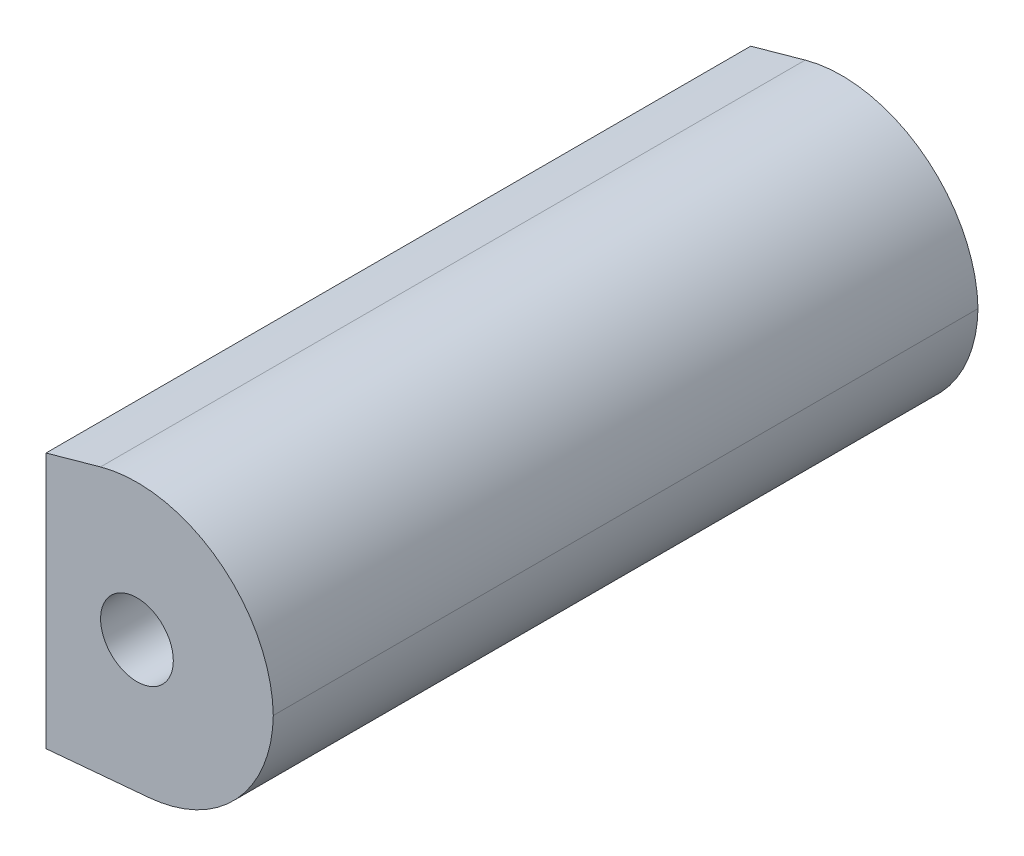
from build123d import *

# Parameters (mm, degrees)
SKETCH1_R               = 2.032
BOSS_EXTRUDE1_DEPTH     = 39.37
CUT_EXTRUDE2_DEPTH      = 62.664828162
CUT_EXTRUDE2_DEPTH_BACK = 62.664828162
SKETCH3_W               = 64.931431167
SKETCH3_H               = 41.251540677


with BuildPart() as part:
    # Sketch1 → Boss-Extrude1 (new body)
    with BuildSketch(Plane.XY):
        with BuildLine():
            ThreePointArc((20.568025107, -2.262743193), (25.492605461, 0.119444869), (27.551899423, 5.187543131))
            ThreePointArc((27.551899423, 5.187543131), (24.489282859, 11.152254923), (17.899072442, 12.38778462))
            add(Edge.make_bspline(
                [(17.899072442, 12.38778462), (11.779016726, 10.69250234), (-2.958574168, 6.431868525), (-24.080278159, -0.407648755), (-34.99363821, -4.735815006), (-48.537358713, -9.634849887), (-43.566754384, -9.118513058)],
                knots=[0, 0, 0, 0, 0.056261028, 0.133578719, 0.179880978, 0.203822749, 0.203822749, 0.203822749, 0.203822749], degree=3))
            add(Edge.make_bspline(
                [(-43.566754384, -9.118513058), (-37.677273054, -7.647687935), (-27.709948033, -7.024655832), (-9.984463479, -4.604286441), (5.433214693, -3.691229751), (16.924119008, -2.567827505), (20.534293367, -2.265562996), (20.568025107, -2.262743193)],
                knots=[0.794337025, 0.794337025, 0.794337025, 0.794337025, 0.852124106, 0.889611916, 0.965358143, 0.999676327, 1, 1, 1, 1], degree=3))
        make_face()
        with Locations((19.933245616, 5.044315447)):
            Circle(SKETCH1_R, mode=Mode.SUBTRACT)
    extrude(amount=BOSS_EXTRUDE1_DEPTH)

    # Sketch3 → Cut-Extrude2 (cut, two sides: drawn at the far end of the back side and taken through both)
    with BuildSketch(Plane.XY.offset(39.37).offset(-CUT_EXTRUDE2_DEPTH_BACK)):
        with Locations((-17.613816161, 2.606074021)):
            Rectangle(SKETCH3_W, SKETCH3_H)
    extrude(amount=CUT_EXTRUDE2_DEPTH + CUT_EXTRUDE2_DEPTH_BACK, mode=Mode.SUBTRACT)


solid = part.part
